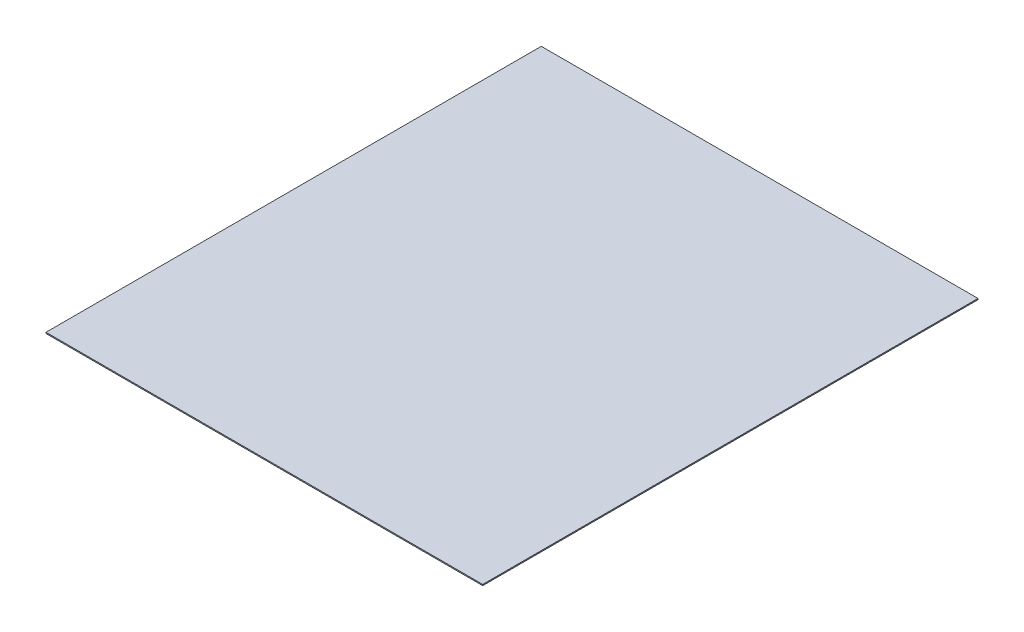
from build123d import *

# Parameters (mm, degrees)
CEK_1L_TEPSI_TABAN_SACI_1_5_1_START = -3
SKETCH1_W                           = 584.6
SKETCH1_H                           = 1.5
CEK_1L_TEPSI_TABAN_SACI_1_5_1_DEPTH = 663


with BuildPart() as part:
    # Sketch1 → CEK_1L_tepsi_taban_saci_1.5_1 (new body)
    with BuildSketch(Plane.XY.offset(CEK_1L_TEPSI_TABAN_SACI_1_5_1_START)):
        with Locations((309, 5.75)):
            Rectangle(SKETCH1_W, SKETCH1_H)
    extrude(amount=-CEK_1L_TEPSI_TABAN_SACI_1_5_1_DEPTH)


solid = part.part
